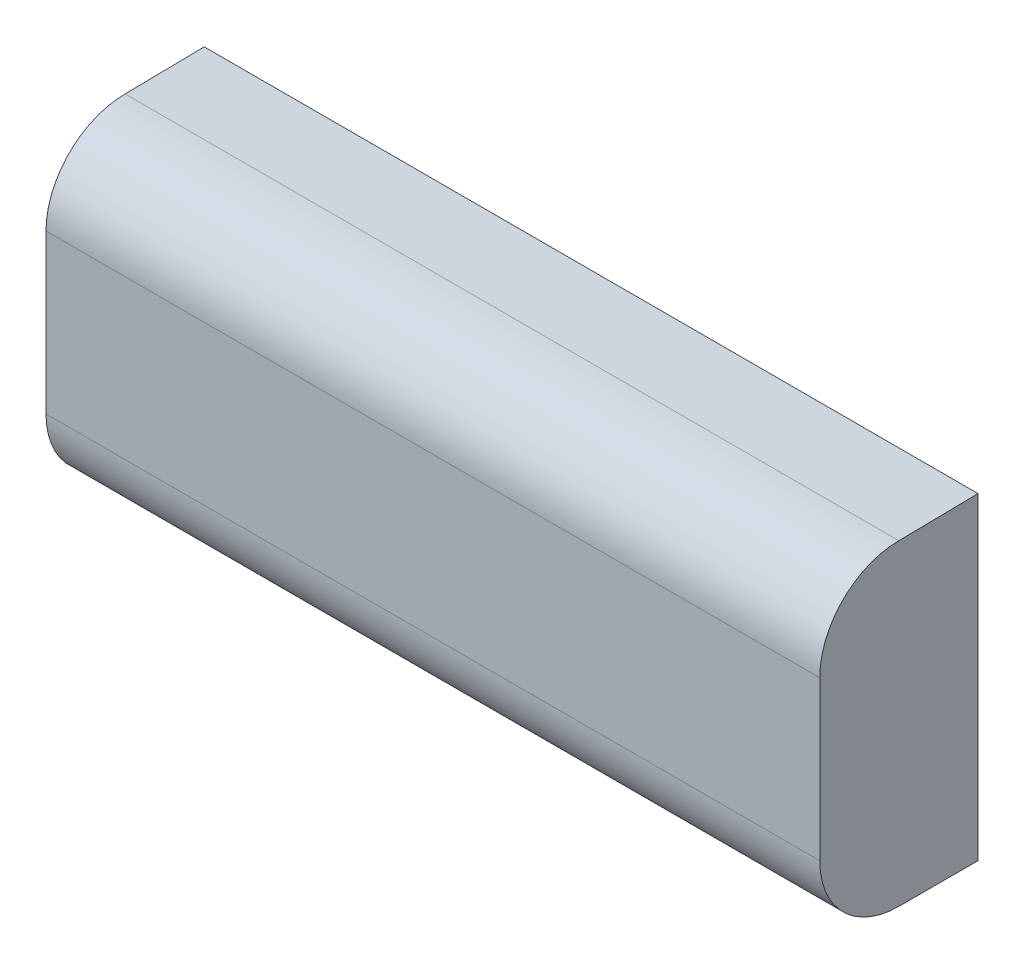
from build123d import *

# Parameters (mm, degrees)
SALIENTE_EXTRUIR1_DEPTH = 372.58


with BuildPart() as part:
    # Croquis1 → Saliente-Extruir1 (new body)
    with BuildSketch(Plane(origin=(0, 0, 0), x_dir=(0, 0, -1), z_dir=(1, 0, 0))):
        with BuildLine():
            Line((38.1, 83.209074357), (0, 82.614095361))
            ThreePointArc((0, 82.614095361), (-26.940768363, 71.454863724), (-38.1, 44.514095361))
            Line((-38.1, 44.514095361), (-38.1, -31.785904639))
            ThreePointArc((-38.1, -31.785904639), (-26.940768363, -58.726673002), (0, -69.885904639))
            Line((0, -69.885904639), (38.1, -69.885904639))
            Line((38.1, -69.885904639), (38.1, 83.209074357))
        make_face()
    extrude(amount=SALIENTE_EXTRUIR1_DEPTH)


solid = part.part
